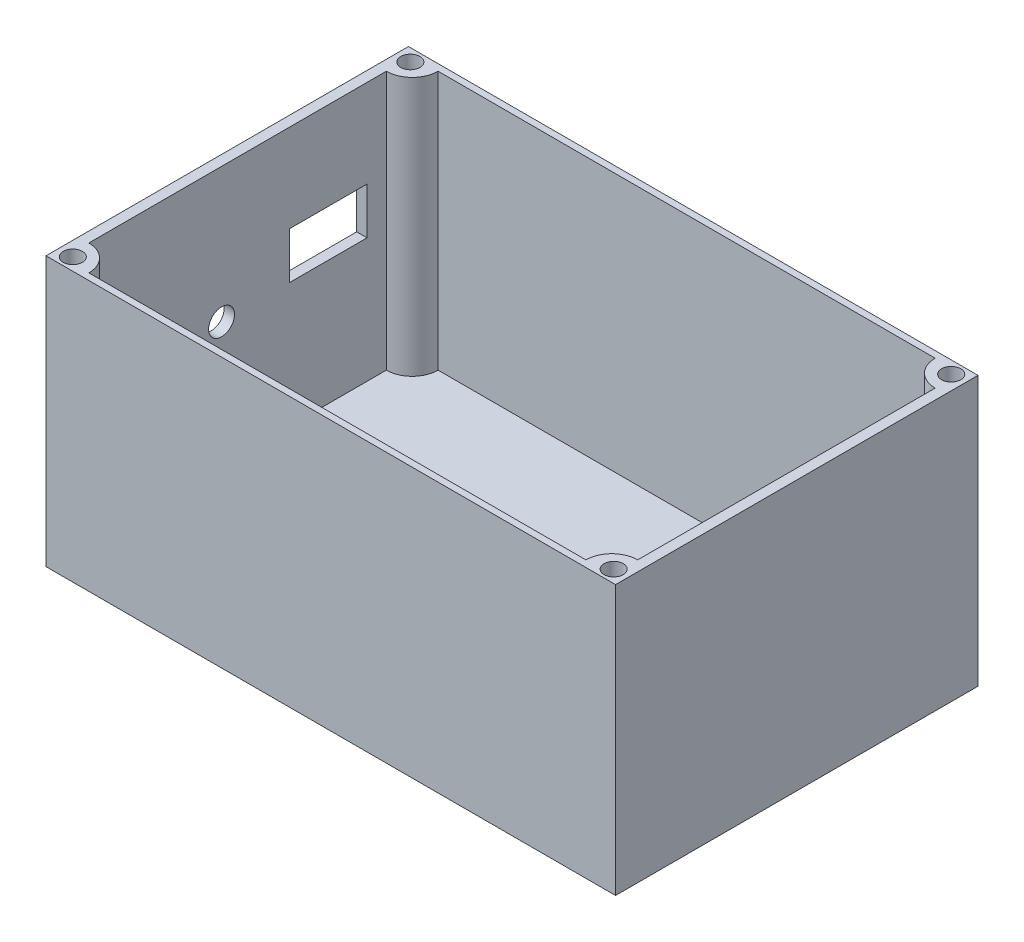
from build123d import *

# Parameters (mm, degrees)
IZIM1_W                     = 110
IZIM1_H                     = 70
Y_KSEKLIK_EKSTR_ZYON1_DEPTH = 2
IZIM2_W                     = 110
IZIM2_H                     = 70
Y_KSEKLIK_EKSTR_ZYON2_DEPTH = 50
IZIM3_R                     = 5.5
KES_EKSTR_ZYON1_DEPTH       = 13
IZIM4_R                     = 2.5
IZIM4_W                     = 15
IZIM4_H                     = 9
KES_EKSTR_ZYON2_DEPTH       = 13
IZIM5_R                     = 1.85
KES_EKSTR_ZYON3_DEPTH       = 67


with BuildPart() as part:
    # Çizim1 → Yükseklik-Ekstrüzyon1 (new body)
    with BuildSketch(Plane(origin=(0, 0, 0), x_dir=(1, 0, 0), z_dir=(0, 1, 0))):
        Rectangle(IZIM1_W, IZIM1_H)
    extrude(amount=Y_KSEKLIK_EKSTR_ZYON1_DEPTH)

    # Çizim2 → Yükseklik-Ekstrüzyon2 (add)
    with BuildSketch(Plane(origin=(0, 2, 0), x_dir=(1, 0, 0), z_dir=(0, 1, 0))):
        Rectangle(IZIM2_W, IZIM2_H)
        with BuildLine():
            Line((-48, -33.727272727), (48, -33.727272727))
            ThreePointArc((48, -33.727272727), (49.464466094, -30.191738821), (53, -28.727272727))
            Line((53, -28.727272727), (53, 28.727272727))
            ThreePointArc((53, 28.727272727), (49.464466094, 30.191738821), (48, 33.727272727))
            Line((48, 33.727272727), (-48, 33.727272727))
            ThreePointArc((-48, 33.727272727), (-49.464466094, 30.191738821), (-53, 28.727272727))
            Line((-53, 28.727272727), (-53, -28.727272727))
            ThreePointArc((-53, -28.727272727), (-49.464466094, -30.191738821), (-48, -33.727272727))
        make_face(mode=Mode.SUBTRACT)
    extrude(amount=Y_KSEKLIK_EKSTR_ZYON2_DEPTH)

    # Çizim3 → Kes-Ekstrüzyon1 (cut)
    with BuildSketch(Plane.ZY.offset(55)):
        with Locations((21.688585695, 26)):
            Circle(IZIM3_R)
    extrude(amount=-KES_EKSTR_ZYON1_DEPTH, mode=Mode.SUBTRACT)

    # Çizim4 → Kes-Ekstrüzyon2 (cut)
    with BuildSketch(Plane.ZY.offset(55)):
        with Locations((3.094292848, 26)):
            Circle(IZIM4_R)
        with Locations((-17.5, 30.5)):
            Rectangle(IZIM4_W, IZIM4_H)
    extrude(amount=-KES_EKSTR_ZYON2_DEPTH, mode=Mode.SUBTRACT)

    # Çizim5 → Kes-Ekstrüzyon3 (cut)
    with BuildSketch(Plane(origin=(0, 52, 0), x_dir=(1, 0, 0), z_dir=(0, 1, 0))):
        with Locations(Location((-52.232233047, 32.595869411, 0), (0, 0, 270))):
            Circle(IZIM5_R)
        with Locations(Location((52.232233047, 32.595869411, 0), (0, 0, 270))):
            Circle(IZIM5_R)
        with Locations(Location((52.232233047, -32.595869411, 0), (0, 0, 270))):
            Circle(IZIM5_R)
        with Locations(Location((-52.232233047, -32.595869411, 0), (0, 0, 270))):
            Circle(IZIM5_R)
    extrude(amount=-KES_EKSTR_ZYON3_DEPTH, mode=Mode.SUBTRACT)


solid = part.part
